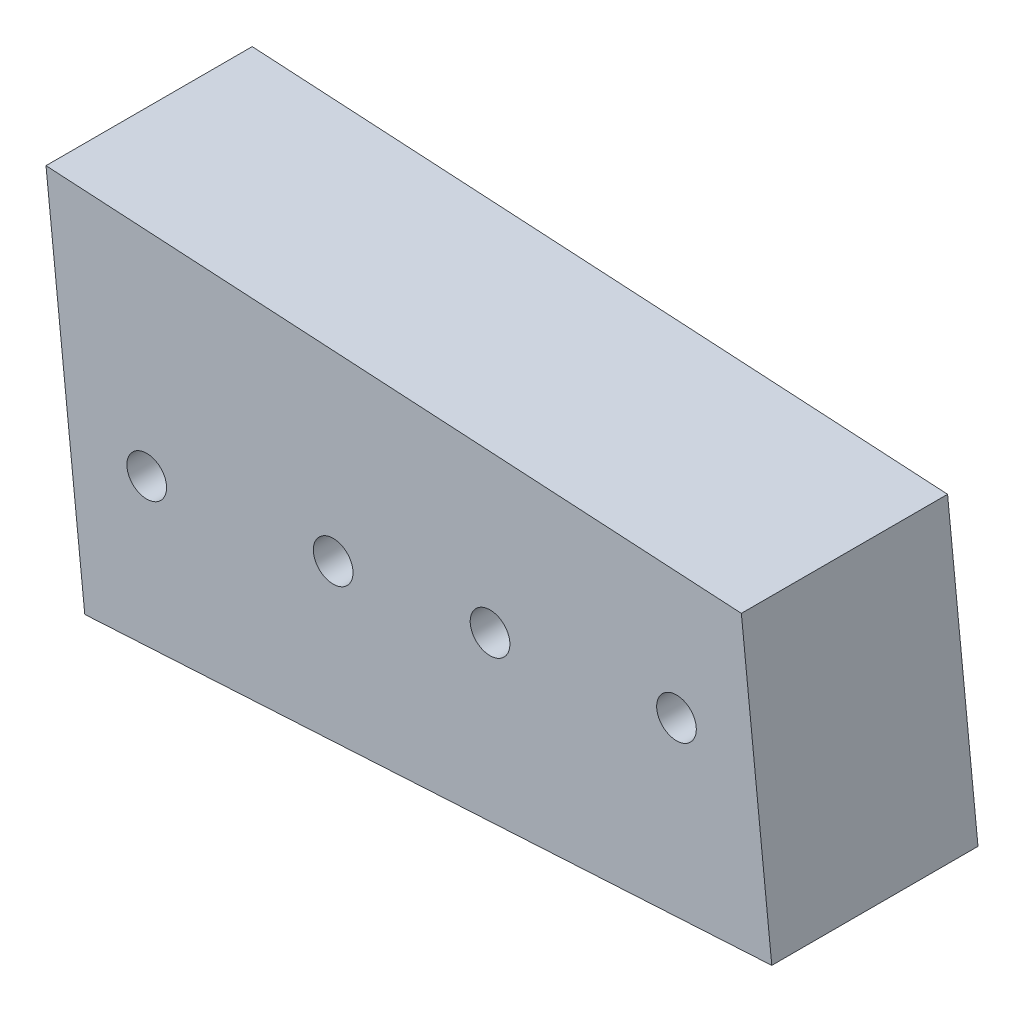
from build123d import *

# Parameters (mm, degrees)
SALIENTE_EXTRUIR1_DEPTH = 16.5
CROQUIS2_R              = 3.175
CORTAR_EXTRUIR1_DEPTH   = 90.961328235


with BuildPart() as part:
    # Croquis1 → Saliente-Extruir1 (new, symmetric)
    with BuildSketch(Plane.XY):
        Polygon((-37.85864365, 29.585656648), (73.418614151, 23.179824137), (78.286202478, -23.179824137), (-31.65396053, -29.508684898), align=None)
    extrude(amount=SALIENTE_EXTRUIR1_DEPTH, both=True)

    # Croquis2 → Cortar-Extruir1 (cut, through all)
    with BuildSketch(Plane.XY.offset(16.5)):
        with Locations((63.036149834, 3.50684658)):
            Circle(CROQUIS2_R)
        with Locations((33.200158154, 0.374179913)):
            Circle(CROQUIS2_R)
        with Locations((8.09814382, -2.261436976)):
            Circle(CROQUIS2_R)
        with Locations((-21.73784786, -5.394103642)):
            Circle(CROQUIS2_R)
    extrude(amount=-CORTAR_EXTRUIR1_DEPTH, mode=Mode.SUBTRACT)


solid = part.part
